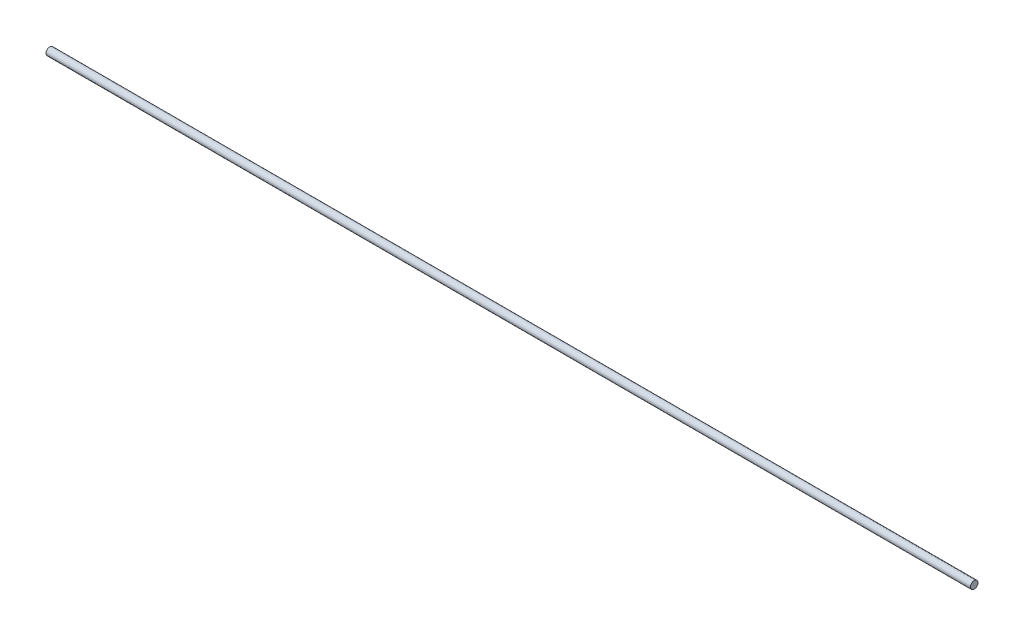
from build123d import *

# Parameters (mm, degrees)
SKETCH1_R           = 1.5
BOSS_EXTRUDE1_DEPTH = 183.5


with BuildPart() as part:
    # Sketch1 → Boss-Extrude1 (new, symmetric)
    with BuildSketch(Plane(origin=(0, 0, 0), x_dir=(0, 0, -1), z_dir=(1, 0, 0))):
        with Locations((179, 57)):
            Circle(SKETCH1_R)
    extrude(amount=BOSS_EXTRUDE1_DEPTH, both=True)


solid = part.part
